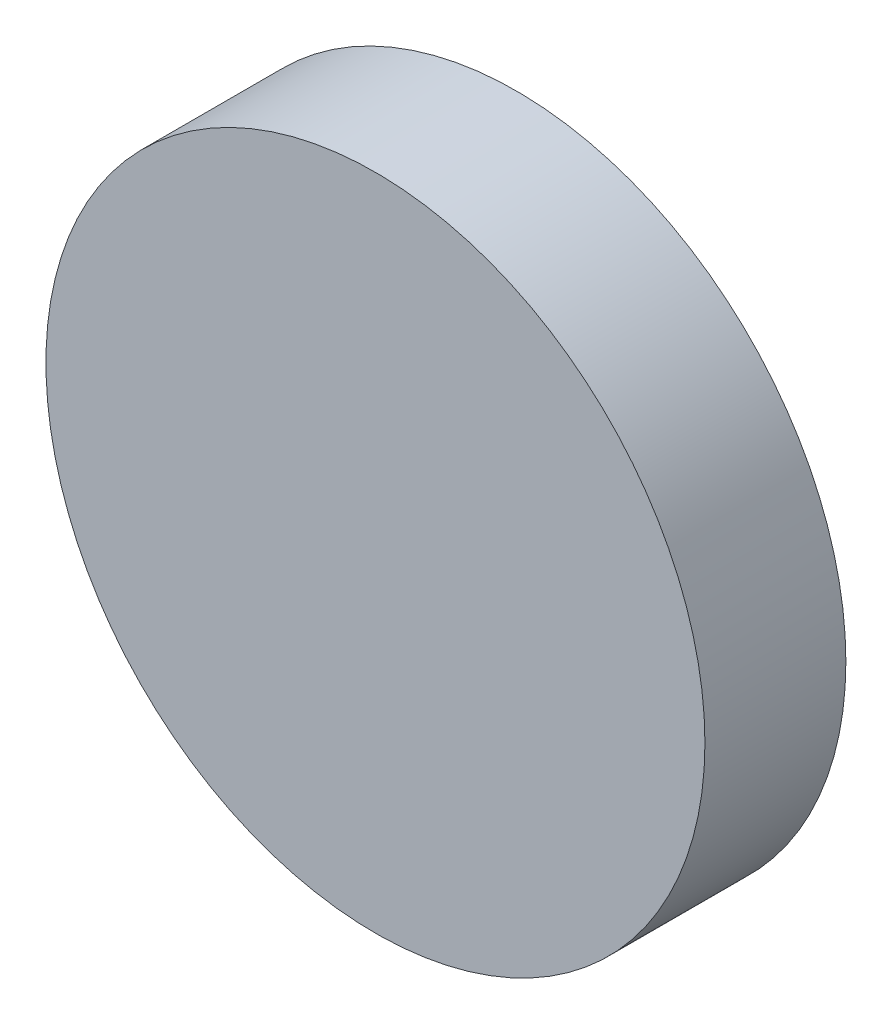
from build123d import *

# Parameters (mm, degrees)
SKETCH1_R           = 25.71585839
BOSS_EXTRUDE1_DEPTH = 11


with BuildPart() as part:
    # Sketch1 → Boss-Extrude1 (new body)
    with BuildSketch(Plane(origin=(-8.85045223, 5.874516708, 0), x_dir=(1, 0, 0), z_dir=(0, 0, 1))):
        with Locations((-8.968210392, 7.945519733)):
            Circle(SKETCH1_R)
    extrude(amount=BOSS_EXTRUDE1_DEPTH)


solid = part.part
